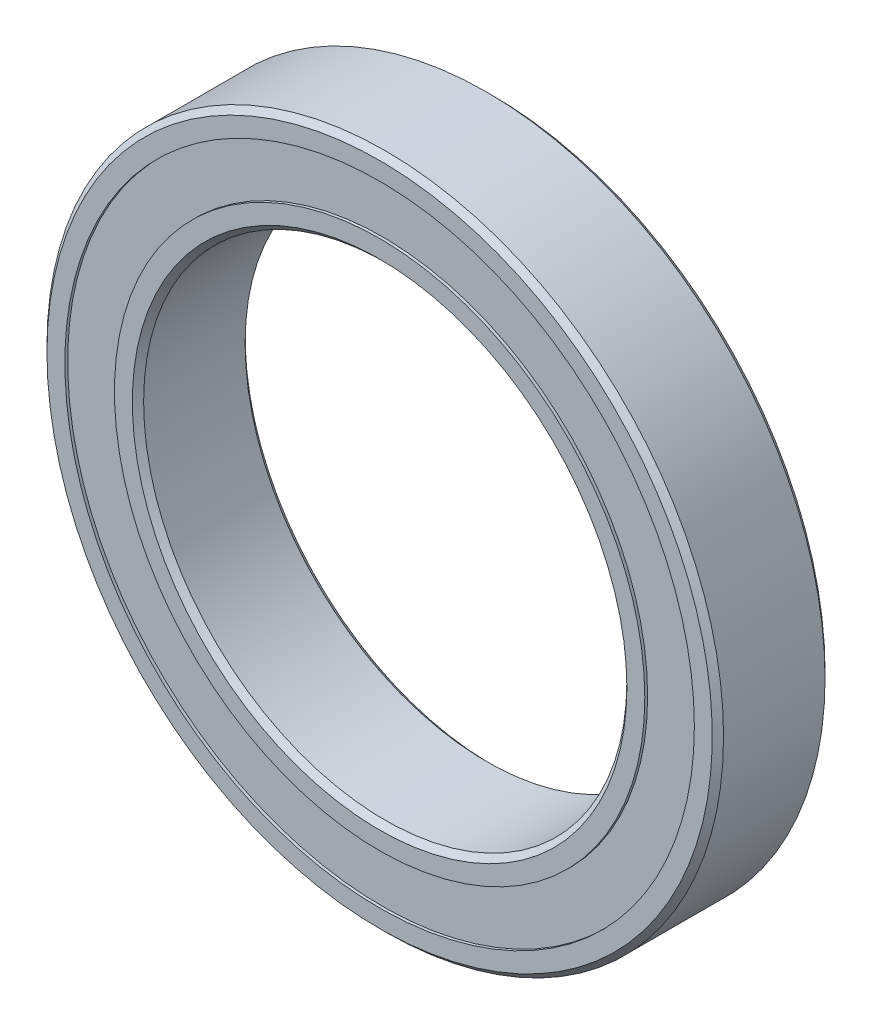
from build123d import *

# Parameters (mm, degrees)
CIRPATTERN1_COUNT = 12


with BuildPart() as part:
    # Sketch6 → Revolve1 (revolve)
    with BuildSketch(Plane(origin=(0, 0, 0), x_dir=(0, 0, -1), z_dir=(1, 0, 0)), mode=Mode.PRIVATE) as revolve1_sk:
        with BuildLine():
            Line((-3.4999999999999996, 20.65000000000001), (-3.4999999999999996, 19.538211538461553))
            Line((-3.4999999999999996, 19.538211538461553), (-1.5555555555555556, 19.538211538461546))
            ThreePointArc((-1.5555555555555556, 19.538211538461546), (1.3e-16, 20.187583858350592), (1.5555555555555556, 19.538211538461546))
            Line((1.5555555555555556, 19.538211538461546), (3.4999999999999996, 19.538211538461553))
            Line((3.4999999999999996, 19.538211538461553), (3.4999999999999996, 20.650000000000002))
            Line((3.4999999999999996, 20.650000000000002), (3.1499999999999972, 21.000000000000004))
            Line((3.1499999999999972, 21.000000000000004), (-3.1499999999999972, 21.000000000000004))
            Line((-3.1499999999999972, 21.000000000000004), (-3.4999999999999996, 20.65000000000001))
        make_face()
        with BuildLine():
            Line((-3.4999999999999996, 15.349500000000013), (-3.4999999999999996, 16.461288461538466))
            Line((-3.4999999999999996, 16.461288461538466), (-1.5555555555555556, 16.461288461538473))
            ThreePointArc((-1.5555555555555556, 16.461288461538473), (1.3e-16, 15.811916141649428), (1.5555555555555556, 16.461288461538473))
            Line((1.5555555555555556, 16.461288461538473), (3.4999999999999996, 16.461288461538466))
            Line((3.4999999999999996, 16.461288461538466), (3.4999999999999996, 15.349500000000013))
            Line((3.4999999999999996, 15.349500000000013), (3.149999999999999, 14.99950000000001))
            Line((3.149999999999999, 14.99950000000001), (-3.149999999999999, 14.999500000000006))
            Line((-3.149999999999999, 14.999500000000006), (-3.4999999999999996, 15.349500000000013))
        make_face()
    revolve(revolve1_sk.sketch.rotate(Axis((0, 0, 3.4999999999999996), (0, 0, -1)), 90), axis=Axis((0, 0, 3.4999999999999996), (0, 0, -1)))



with BuildPart() as body_2:
    # Sketch4 → Revolve2 (revolve)
    with BuildSketch(Plane(origin=(0, 0, 0), x_dir=(0, 0, -1), z_dir=(1, 0, 0))):
        with BuildLine():
            Line((-2.1878338583505816, 17.99975000000001), (2.1878338583505816, 17.99975000000001))
            ThreePointArc((2.1878338583505816, 17.99975000000001), (1.3e-16, 20.187583858350592), (-2.1878338583505816, 17.99975000000001))
        make_face()
    revolve(axis=Axis((0, 17.99975000000001, 2.1878338583505816), (0, 0, -1)))


with BuildPart() as cirpattern1_1:
    # CirPattern1: pattern copy
    add(body_2.part.rotate(Axis((9e-17, -3.4e-16, 0), (0, 0, 1)), 1 * 360 / CIRPATTERN1_COUNT))


with BuildPart() as cirpattern1_2:
    # CirPattern1: pattern copy
    add(body_2.part.rotate(Axis((9e-17, -3.4e-16, 0), (0, 0, 1)), 2 * 360 / CIRPATTERN1_COUNT))


with BuildPart() as cirpattern1_3:
    # CirPattern1: pattern copy
    add(body_2.part.rotate(Axis((9e-17, -3.4e-16, 0), (0, 0, 1)), 3 * 360 / CIRPATTERN1_COUNT))


with BuildPart() as cirpattern1_4:
    # CirPattern1: pattern copy
    add(body_2.part.rotate(Axis((9e-17, -3.4e-16, 0), (0, 0, 1)), 4 * 360 / CIRPATTERN1_COUNT))


with BuildPart() as cirpattern1_5:
    # CirPattern1: pattern copy
    add(body_2.part.rotate(Axis((9e-17, -3.4e-16, 0), (0, 0, 1)), 5 * 360 / CIRPATTERN1_COUNT))


with BuildPart() as cirpattern1_6:
    # CirPattern1: pattern copy
    add(body_2.part.rotate(Axis((9e-17, -3.4e-16, 0), (0, 0, 1)), 6 * 360 / CIRPATTERN1_COUNT))


with BuildPart() as cirpattern1_7:
    # CirPattern1: pattern copy
    add(body_2.part.rotate(Axis((9e-17, -3.4e-16, 0), (0, 0, 1)), 7 * 360 / CIRPATTERN1_COUNT))


with BuildPart() as cirpattern1_8:
    # CirPattern1: pattern copy
    add(body_2.part.rotate(Axis((9e-17, -3.4e-16, 0), (0, 0, 1)), 8 * 360 / CIRPATTERN1_COUNT))


with BuildPart() as cirpattern1_9:
    # CirPattern1: pattern copy
    add(body_2.part.rotate(Axis((9e-17, -3.4e-16, 0), (0, 0, 1)), 9 * 360 / CIRPATTERN1_COUNT))


with BuildPart() as cirpattern1_10:
    # CirPattern1: pattern copy
    add(body_2.part.rotate(Axis((9e-17, -3.4e-16, 0), (0, 0, 1)), 10 * 360 / CIRPATTERN1_COUNT))


with BuildPart() as cirpattern1_11:
    # CirPattern1: pattern copy
    add(body_2.part.rotate(Axis((9e-17, -3.4e-16, 0), (0, 0, 1)), 11 * 360 / CIRPATTERN1_COUNT))


with BuildPart() as part_1:
    add(part.part)

    add(body_2.part)  # Revolve3 merges body 2

    add(cirpattern1_1.part)  # Revolve3 merges CirPattern1_1

    add(cirpattern1_2.part)  # Revolve3 merges CirPattern1_2

    add(cirpattern1_3.part)  # Revolve3 merges CirPattern1_3

    add(cirpattern1_4.part)  # Revolve3 merges CirPattern1_4

    add(cirpattern1_5.part)  # Revolve3 merges CirPattern1_5

    add(cirpattern1_6.part)  # Revolve3 merges CirPattern1_6

    add(cirpattern1_7.part)  # Revolve3 merges CirPattern1_7

    add(cirpattern1_8.part)  # Revolve3 merges CirPattern1_8

    add(cirpattern1_9.part)  # Revolve3 merges CirPattern1_9

    add(cirpattern1_10.part)  # Revolve3 merges CirPattern1_10

    add(cirpattern1_11.part)  # Revolve3 merges CirPattern1_11
    # Sketch5 → Revolve3 (revolve)
    with BuildSketch(Plane(origin=(0, 0, 0), x_dir=(0, 0, -1), z_dir=(1, 0, 0)), mode=Mode.PRIVATE) as revolve3_sk:
        Polygon((-3.324999999999993, 19.538211538461553), (-2.1878338583505816, 19.538211538461553), (-2.1878338583505808, 16.461288461538466), (-3.324999999999992, 16.461288461538466), align=None)
        Polygon((3.324999999999993, 19.538211538461553), (2.1878338583505816, 19.538211538461553), (2.1878338583505825, 16.461288461538466), (3.324999999999993, 16.461288461538466), align=None)
    revolve(revolve3_sk.sketch.rotate(Axis((0, 0, 3.4999999999999996), (0, 0, -1)), 90), axis=Axis((0, 0, 3.4999999999999996), (0, 0, -1)))


solid = part_1.part
